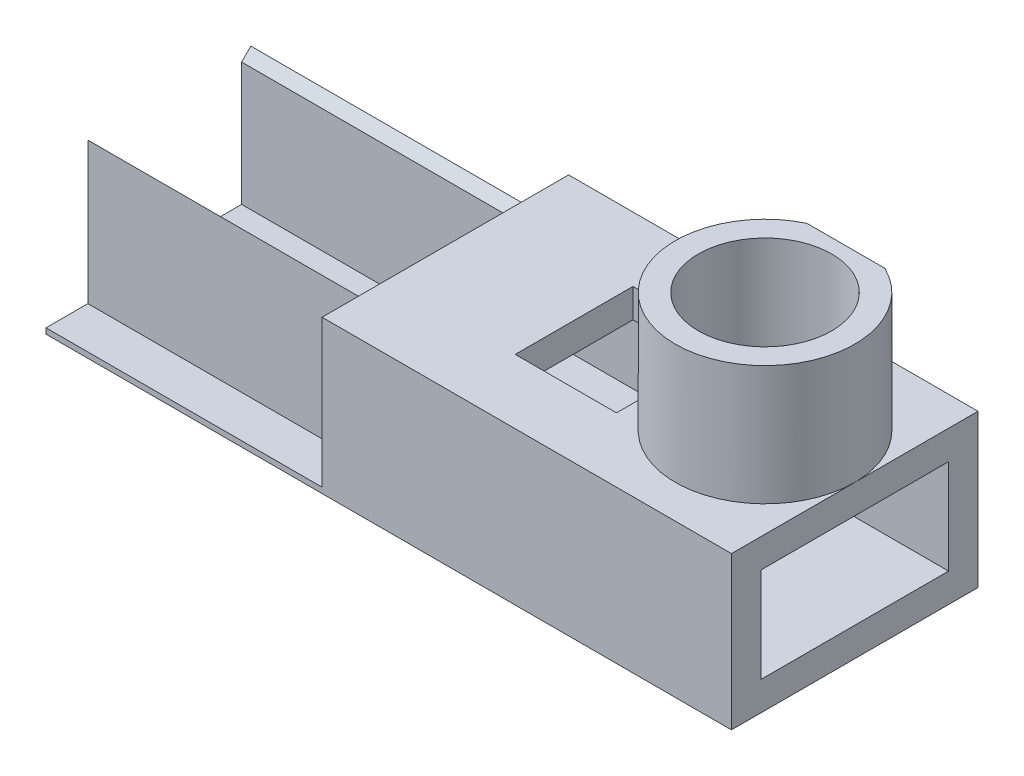
from build123d import *

# Parameters (mm, degrees)
SKETCH2_W            = 26.8
SKETCH2_H            = 16.6
SKETCH2_W_2          = 20.8
SKETCH2_H_2          = 10.6
BOSS_EXTRUDE3_DEPTH  = 19.5
SKETCH8_R            = 9.75
SKETCH8_R_2          = 7.25
BOSS_EXTRUDE5_DEPTH  = 13.010482488
CUT_EXTRUDE1_START   = -5
SKETCH9_R            = 7.25
CUT_EXTRUDE1_DEPTH   = 5
SKETCH11_W           = 20.8
SKETCH11_H           = 10.6
SKETCH11_W_2         = 20.4
SKETCH11_H_2         = 10.3
BOSS_EXTRUDE7_DEPTH  = 19.5
SKETCH12_R           = 7.248274147
CUT_EXTRUDE3_DEPTH   = 4
SKETCH14_W           = 26.8
SKETCH14_H           = 16.6
SKETCH14_W_2         = 20.4
SKETCH14_H_2         = 10.3
BOSS_EXTRUDE8_DEPTH  = 24
SKETCH15_R           = 8
CUT_EXTRUDE5_DEPTH   = 5
SKETCH16_W           = 11.004107939
SKETCH16_H           = 12.8
CUT_EXTRUDE6_DEPTH   = 5
CHAMFER4_SIZE        = 2
SKETCH17_W           = 26.8
SKETCH17_H           = 16.6
BOSS_EXTRUDE9_DEPTH  = 1
SKETCH18_R           = 4
CUT_EXTRUDE7_DEPTH   = 1
BOSS_EXTRUDE11_DEPTH = 30
SKETCH20_W           = 30.011261772
SKETCH20_H           = 26.8
BOSS_EXTRUDE12_DEPTH = 0.6
SKETCH23_R           = 6.70324332
CUT_EXTRUDE9_DEPTH   = 5
SKETCH25_W           = 20.840121468
SKETCH25_H           = 2.448199345
CUT_EXTRUDE10_DEPTH  = 13.01


with BuildPart() as part:
    # Sketch2 → Boss-Extrude3 (new body)
    with BuildSketch(Plane(origin=(0, 0, 0), x_dir=(0, 0, -1), z_dir=(1, 0, 0))):
        with Locations((9.011494253, 5.445783842)):
            Rectangle(SKETCH2_W, SKETCH2_H)
        with Locations((9.011494253, 5.445783842)):
            Rectangle(SKETCH2_W_2, SKETCH2_H_2, mode=Mode.SUBTRACT)
    extrude(amount=BOSS_EXTRUDE3_DEPTH)

    # Sketch8 → Boss-Extrude5 (add)
    with BuildSketch(Plane(origin=(0, 13.745783842, 0), x_dir=(1, 0, 0), z_dir=(0, 1, 0))):
        with Locations(Location((9.75, 9.011494253, 0), (0, 0, 180))):
            Circle(SKETCH8_R)
        with Locations(Location((9.75, 9.011494253, 0), (0, 0, 270))):
            Circle(SKETCH8_R_2, mode=Mode.SUBTRACT)
    extrude(amount=BOSS_EXTRUDE5_DEPTH)

    # Sketch9 → Cut-Extrude1 (cut)
    with BuildSketch(Plane(origin=(0, 13.745783842, 0), x_dir=(1, 0, 0), z_dir=(0, 1, 0)).offset(CUT_EXTRUDE1_START)):
        with Locations(Location((9.75, 9.011494253, 0), (0, 0, 270))):
            Circle(SKETCH9_R)
    extrude(amount=CUT_EXTRUDE1_DEPTH, mode=Mode.SUBTRACT)

    # Sketch11 → Boss-Extrude7 (add)
    with BuildSketch(Plane.ZY):
        with Locations((-9.011494253, 5.445783842)):
            Rectangle(SKETCH11_W, SKETCH11_H)
        with Locations((-9.011494253, 5.445783842)):
            Rectangle(SKETCH11_W_2, SKETCH11_H_2, mode=Mode.SUBTRACT)
    extrude(amount=-BOSS_EXTRUDE7_DEPTH)

    # Sketch12 → Cut-Extrude3 (cut)
    with BuildSketch(Plane(origin=(0, 13.745783842, 0), x_dir=(1, 0, 0), z_dir=(0, 1, 0))):
        with Locations(Location((9.75, 9.011494253, 0), (0, 0, 270))):
            Circle(SKETCH12_R)
    extrude(amount=-CUT_EXTRUDE3_DEPTH, mode=Mode.SUBTRACT)

    # Sketch14 → Boss-Extrude8 (add)
    with BuildSketch(Plane.ZY):
        with Locations((-9.011494253, 5.445783842)):
            Rectangle(SKETCH14_W, SKETCH14_H)
        with Locations((-9.011494253, 5.445783842)):
            Rectangle(SKETCH14_W_2, SKETCH14_H_2, mode=Mode.SUBTRACT)
    extrude(amount=BOSS_EXTRUDE8_DEPTH)

    # Sketch15 → Cut-Extrude5 (cut)
    with BuildSketch(Plane.XZ.offset(2.854216158)):
        with Locations(Location((-1.242459593, -9.011494253, 0), (0, 0, 270))):
            Circle(SKETCH15_R)
    extrude(amount=-CUT_EXTRUDE5_DEPTH, mode=Mode.SUBTRACT)

    # Sketch16 → Cut-Extrude6 (cut)
    with BuildSketch(Plane(origin=(0, 13.745783842, 0), x_dir=(1, 0, 0), z_dir=(0, 1, 0))):
        with Locations((-5.50205397, 9.011494253)):
            Rectangle(SKETCH16_W, SKETCH16_H)
    extrude(amount=-CUT_EXTRUDE6_DEPTH, mode=Mode.SUBTRACT)

    # Chamfer4
    chamfer4_edges = [part.edges().sort_by_distance(p)[0] for p in [
        (-1.242459593, 0.295783842, -1.011494253),
    ]]
    chamfer(chamfer4_edges, length=CHAMFER4_SIZE)

    # Sketch17 → Boss-Extrude9 (add)
    with BuildSketch(Plane.ZY.offset(24)):
        with Locations((-9.011494253, 5.445783842)):
            Rectangle(SKETCH17_W, SKETCH17_H)
    extrude(amount=BOSS_EXTRUDE9_DEPTH)

    # Sketch18 → Cut-Extrude7 (cut)
    with BuildSketch(Plane.ZY.offset(25)):
        with Locations((-9.011494253, 5.445783842)):
            Circle(SKETCH18_R)
    extrude(amount=-CUT_EXTRUDE7_DEPTH, mode=Mode.SUBTRACT)

    # Sketch19 → Boss-Extrude11 (add)
    with BuildSketch(Plane.ZY.offset(25)):
        Polygon((-0.161494253, 13.145783842), (-0.161494253, -2.254216158), (-17.861494253, -2.254216158), (-17.861494253, 13.145783842), (-16.861494253, 12.145783842), (-16.861494253, -1.254216158), (-1.161494253, -1.254216158), (-1.161494253, 12.145783842), align=None)
    extrude(amount=BOSS_EXTRUDE11_DEPTH)

    # Sketch20 → Boss-Extrude12 (add)
    with BuildSketch(Plane.XZ.offset(2.254216158)):
        with Locations((-40.005630886, -9.011494253)):
            Rectangle(SKETCH20_W, SKETCH20_H)
    extrude(amount=BOSS_EXTRUDE12_DEPTH)

    # Sketch23 → Cut-Extrude9 (cut)
    with BuildSketch(Plane(origin=(-24, 0, 0), x_dir=(0, 0, -1), z_dir=(1, 0, 0))):
        with Locations((9.011494253, 5.445783842)):
            Circle(SKETCH23_R)
    extrude(amount=CUT_EXTRUDE9_DEPTH, mode=Mode.SUBTRACT)

    # Sketch25 → Cut-Extrude10 (cut)
    with BuildSketch(Plane(origin=(0, 26.756266329, 0), x_dir=(1, 0, 0), z_dir=(0, 1, 0))):
        with Locations((10.420060734, 19.018301842)):
            Rectangle(SKETCH25_W, SKETCH25_H)
    extrude(amount=-CUT_EXTRUDE10_DEPTH, mode=Mode.SUBTRACT)


solid = part.part
